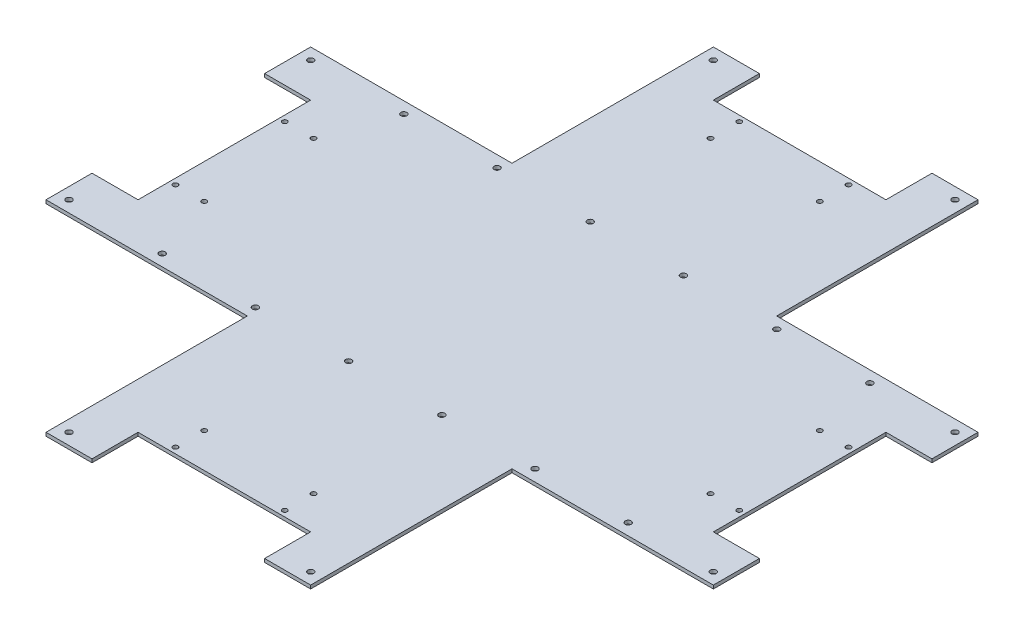
from build123d import *

# Parameters (mm, degrees)
SKETCH_1_R      = 2.6
SKETCH_1_R_2    = 2.15
EXTRUDE_1_DEPTH = 3


with BuildPart() as part:
    # 草图1 → 凸台-拉伸1 (new body)
    with BuildSketch(Plane(origin=(0, 0, 0), x_dir=(1, 0, 0), z_dir=(0, 1, 0))):
        Polygon((-75, 290), (-115, 290), (-115, 115), (-290, 115), (-290, 75), (-250, 75), (-250, -75), (-290, -75), (-290, -115), (-115, -115), (-115, -290), (-75, -290), (-75, -250), (75, -250), (75, -290), (115, -290), (115, -115), (290, -115), (290, -75), (250, -75), (250, 75), (290, 75), (290, 115), (115, 115), (115, 290), (75, 290), (75, 250), (-75, 250), align=None)
        with Locations(Location((-105, 280, 0), (0, 0, 270))):
            Circle(SKETCH_1_R, mode=Mode.SUBTRACT)
        with Locations(Location((-47.5, 220, 0), (0, 0, 270))):
            Circle(SKETCH_1_R_2, mode=Mode.SUBTRACT)
        with Locations(Location((-47.5, 245, 0), (0, 0, 270))):
            Circle(SKETCH_1_R_2, mode=Mode.SUBTRACT)
        with Locations(Location((47.5, 220, 0), (0, 0, 270))):
            Circle(SKETCH_1_R_2, mode=Mode.SUBTRACT)
        with Locations(Location((47.5, 245, 0), (0, 0, 270))):
            Circle(SKETCH_1_R_2, mode=Mode.SUBTRACT)
        with Locations(Location((105, 280, 0), (0, 0, 270))):
            Circle(SKETCH_1_R, mode=Mode.SUBTRACT)
        with Locations(Location((44, 105, 0), (0, 0, 270))):
            Circle(SKETCH_1_R, mode=Mode.SUBTRACT)
        with Locations(Location((-37, -105, 0), (0, 0, 270))):
            Circle(SKETCH_1_R, mode=Mode.SUBTRACT)
        with Locations(Location((44, -105, 0), (0, 0, 270))):
            Circle(SKETCH_1_R, mode=Mode.SUBTRACT)
        with Locations(Location((-37, 105, 0), (0, 0, 270))):
            Circle(SKETCH_1_R, mode=Mode.SUBTRACT)
        with Locations(Location((-118, 105, 0), (0, 0, 270))):
            Circle(SKETCH_1_R, mode=Mode.SUBTRACT)
        with Locations(Location((-280, -105, 0), (0, 0, 270))):
            Circle(SKETCH_1_R, mode=Mode.SUBTRACT)
        with Locations(Location((-199, -105, 0), (0, 0, 270))):
            Circle(SKETCH_1_R, mode=Mode.SUBTRACT)
        with Locations(Location((-245, -47.5, 0), (0, 0, 270))):
            Circle(SKETCH_1_R_2, mode=Mode.SUBTRACT)
        with Locations(Location((-220, -47.5, 0), (0, 0, 270))):
            Circle(SKETCH_1_R_2, mode=Mode.SUBTRACT)
        with Locations(Location((-118, -105, 0), (0, 0, 270))):
            Circle(SKETCH_1_R, mode=Mode.SUBTRACT)
        with Locations(Location((-245, 47.5, 0), (0, 0, 270))):
            Circle(SKETCH_1_R_2, mode=Mode.SUBTRACT)
        with Locations(Location((-220, 47.5, 0), (0, 0, 270))):
            Circle(SKETCH_1_R_2, mode=Mode.SUBTRACT)
        with Locations(Location((-280, 105, 0), (0, 0, 270))):
            Circle(SKETCH_1_R, mode=Mode.SUBTRACT)
        with Locations(Location((-199, 105, 0), (0, 0, 270))):
            Circle(SKETCH_1_R, mode=Mode.SUBTRACT)
        with Locations(Location((105, -280, 0), (0, 0, 270))):
            Circle(SKETCH_1_R, mode=Mode.SUBTRACT)
        with Locations(Location((-105, -280, 0), (0, 0, 270))):
            Circle(SKETCH_1_R, mode=Mode.SUBTRACT)
        with Locations(Location((-47.5, -245, 0), (0, 0, 270))):
            Circle(SKETCH_1_R_2, mode=Mode.SUBTRACT)
        with Locations(Location((-47.5, -220, 0), (0, 0, 270))):
            Circle(SKETCH_1_R_2, mode=Mode.SUBTRACT)
        with Locations(Location((47.5, -245, 0), (0, 0, 270))):
            Circle(SKETCH_1_R_2, mode=Mode.SUBTRACT)
        with Locations(Location((47.5, -220, 0), (0, 0, 270))):
            Circle(SKETCH_1_R_2, mode=Mode.SUBTRACT)
        with Locations(Location((280, 105, 0), (0, 0, 270))):
            Circle(SKETCH_1_R, mode=Mode.SUBTRACT)
        with Locations(Location((125, -105, 0), (0, 0, 270))):
            Circle(SKETCH_1_R, mode=Mode.SUBTRACT)
        with Locations(Location((206, -105, 0), (0, 0, 270))):
            Circle(SKETCH_1_R, mode=Mode.SUBTRACT)
        with Locations(Location((280, -105, 0), (0, 0, 270))):
            Circle(SKETCH_1_R, mode=Mode.SUBTRACT)
        with Locations(Location((220, -47.5, 0), (0, 0, 270))):
            Circle(SKETCH_1_R_2, mode=Mode.SUBTRACT)
        with Locations(Location((245, -47.5, 0), (0, 0, 270))):
            Circle(SKETCH_1_R_2, mode=Mode.SUBTRACT)
        with Locations(Location((125, 105, 0), (0, 0, 270))):
            Circle(SKETCH_1_R, mode=Mode.SUBTRACT)
        with Locations(Location((220, 47.5, 0), (0, 0, 270))):
            Circle(SKETCH_1_R_2, mode=Mode.SUBTRACT)
        with Locations(Location((245, 47.5, 0), (0, 0, 270))):
            Circle(SKETCH_1_R_2, mode=Mode.SUBTRACT)
        with Locations(Location((206, 105, 0), (0, 0, 270))):
            Circle(SKETCH_1_R, mode=Mode.SUBTRACT)
    extrude(amount=EXTRUDE_1_DEPTH)


solid = part.part
